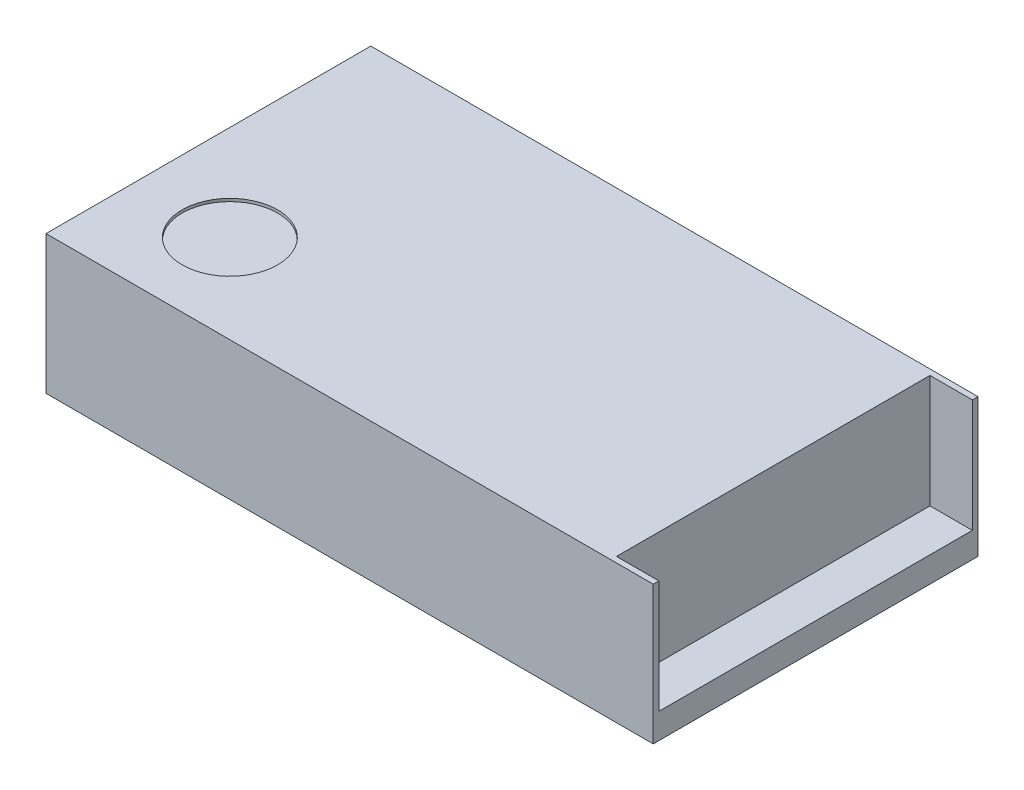
from build123d import *

# Parameters (mm, degrees)
SKETCH1_W           = 215
SKETCH1_H           = 115
BOSS_EXTRUDE1_DEPTH = 49
SKETCH2_R           = 16.899563319
CUT_EXTRUDE1_DEPTH  = 1
SKETCH4_W           = 15
SKETCH4_H           = 111
CUT_EXTRUDE2_DEPTH  = 40


with BuildPart() as part:
    # Sketch1 → Boss-Extrude1 (new body)
    with BuildSketch(Plane(origin=(0, 0, 0), x_dir=(1, 0, 0), z_dir=(0, 1, 0))):
        Rectangle(SKETCH1_W, SKETCH1_H)
    extrude(amount=BOSS_EXTRUDE1_DEPTH)

    # Sketch2 → Cut-Extrude1 (cut)
    with BuildSketch(Plane(origin=(0, 49, 0), x_dir=(1, 0, 0), z_dir=(0, 1, 0))):
        with Locations(Location((-73.794759825, -26.100436681, 0), (0, 0, 270))):
            Circle(SKETCH2_R)
    extrude(amount=-CUT_EXTRUDE1_DEPTH, mode=Mode.SUBTRACT)

    # Sketch4 → Cut-Extrude2 (cut)
    with BuildSketch(Plane(origin=(0, 49, 0), x_dir=(1, 0, 0), z_dir=(0, 1, 0))):
        with Locations((100, 0)):
            Rectangle(SKETCH4_W, SKETCH4_H)
    extrude(amount=-CUT_EXTRUDE2_DEPTH, mode=Mode.SUBTRACT)


solid = part.part
